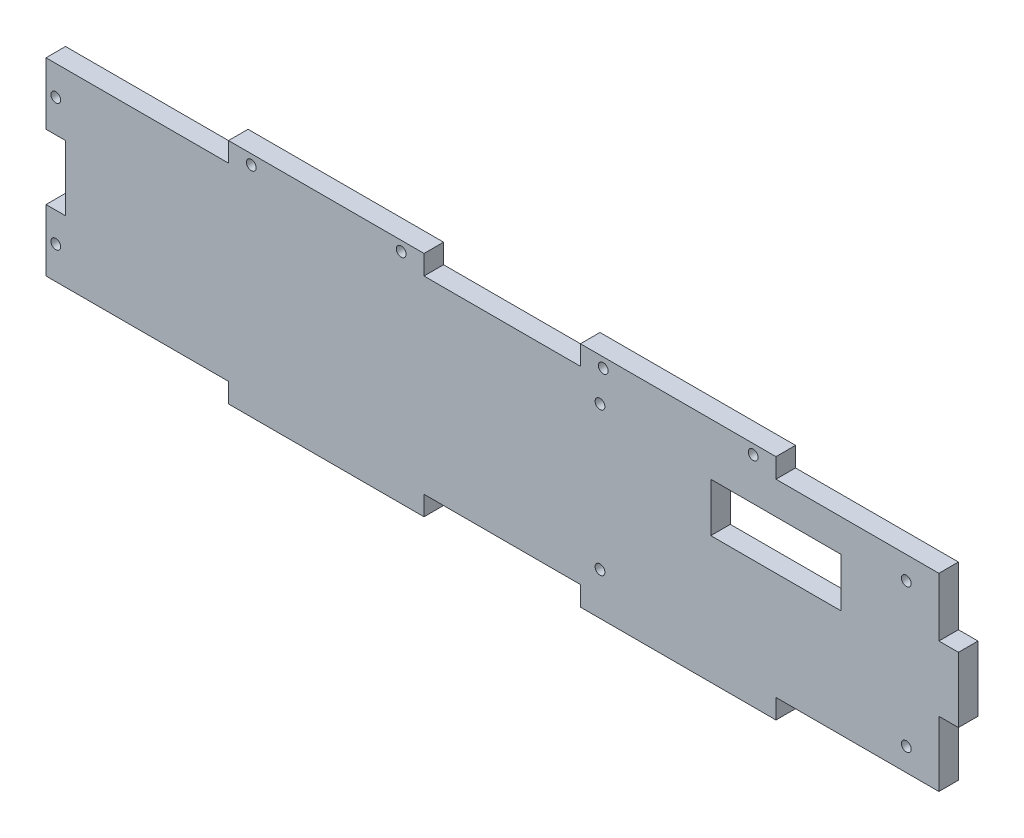
from build123d import *

# Parameters (mm, degrees)
ESQUISSE1_W             = 268
ESQUISSE1_H             = 70
BOSS_EXTRU_1_DEPTH      = 6
ESQUISSE2_W             = 50
ESQUISSE2_H             = 6
ESQUISSE2_W_2           = 48
ENL_V_MAT_EXTRU_1_DEPTH = 278.055951028
ESQUISSE3_W             = 6
ESQUISSE3_H             = 20
BOSS_EXTRU_2_DEPTH      = 6
ESQUISSE4_R             = 1.5
ESQUISSE4_W             = 40
ESQUISSE4_H             = 15
ENL_V_MAT_EXTRU_2_DEPTH = 10
ESQUISSE5_W             = 6
ESQUISSE5_H             = 19
BOSS_EXTRU_3_DEPTH      = 6
ESQUISSE6_R             = 1.5
ENL_V_MAT_EXTRU_3_DEPTH = 283.863924883
ESQUISSE7_R             = 2.995
ESQUISSE7_R_2           = 3
ENL_V_MAT_EXTRU_4_DEPTH = 3


with BuildPart() as part:
    # Esquisse1 → Boss.-Extru.1 (new body)
    with BuildSketch(Plane.XY):
        with Locations((-134, 35)):
            Rectangle(ESQUISSE1_W, ESQUISSE1_H)
    extrude(amount=BOSS_EXTRU_1_DEPTH)

    # Esquisse2 → Enlèv. mat.-Extru.1 (cut, through all)
    with BuildSketch(Plane.XY.offset(6)):
        with Locations((-243, 3)):
            Rectangle(ESQUISSE2_W, ESQUISSE2_H)
        with Locations((-25, 3)):
            Rectangle(ESQUISSE2_W, ESQUISSE2_H)
        with Locations((-134, 3)):
            Rectangle(ESQUISSE2_W_2, ESQUISSE2_H)
        with Locations((-243, 67)):
            Rectangle(ESQUISSE2_W, ESQUISSE2_H)
        with Locations((-134, 67)):
            Rectangle(ESQUISSE2_W_2, ESQUISSE2_H)
        with Locations((-25, 67)):
            Rectangle(ESQUISSE2_W, ESQUISSE2_H)
    extrude(amount=-ENL_V_MAT_EXTRU_1_DEPTH, mode=Mode.SUBTRACT)

    # Esquisse3 → Boss.-Extru.2 (add)
    with BuildSketch(Plane(origin=(0, 0, 0), x_dir=(0, 0, -1), z_dir=(1, 0, 0))):
        with Locations((-3, 36)):
            Rectangle(ESQUISSE3_W, ESQUISSE3_H)
    extrude(amount=BOSS_EXTRU_2_DEPTH)

    # Esquisse4 → Enlèv. mat.-Extru.2 (cut)
    with BuildSketch(Plane.XY.offset(6)):
        with Locations((-104, 57)):
            Circle(ESQUISSE4_R)
        with Locations((-104, 13)):
            Circle(ESQUISSE4_R)
        with Locations((-10, 57)):
            Circle(ESQUISSE4_R)
        with Locations((-10, 13)):
            Circle(ESQUISSE4_R)
        with Locations((-50, 46.5)):
            Rectangle(ESQUISSE4_W, ESQUISSE4_H)
    extrude(amount=-ENL_V_MAT_EXTRU_2_DEPTH, mode=Mode.SUBTRACT)

    # Esquisse5 → Boss.-Extru.3 (add)
    with BuildSketch(Plane.ZY.offset(268)):
        with Locations((3, 54.5)):
            Rectangle(ESQUISSE5_W, ESQUISSE5_H)
        with Locations((3, 15.5)):
            Rectangle(ESQUISSE5_W, ESQUISSE5_H)
    extrude(amount=BOSS_EXTRU_3_DEPTH)

    # Esquisse6 → Enlèv. mat.-Extru.3 (cut, through all)
    with BuildSketch(Plane(origin=(0, 0, 0), x_dir=(-1, 0, 0), z_dir=(0, 0, -1))):
        with Locations((271, 16)):
            Circle(ESQUISSE6_R)
        with Locations((271, 55)):
            Circle(ESQUISSE6_R)
        with Locations((211, 67)):
            Circle(ESQUISSE6_R)
        with Locations((165, 67)):
            Circle(ESQUISSE6_R)
        with Locations((103, 67)):
            Circle(ESQUISSE6_R)
        with Locations((57, 67)):
            Circle(ESQUISSE6_R)
    extrude(amount=-ENL_V_MAT_EXTRU_3_DEPTH, mode=Mode.SUBTRACT)

    # Esquisse7 → Enlèv. mat.-Extru.4 (cut)
    with BuildSketch(Plane(origin=(0, 0, 0), x_dir=(-1, 0, 0), z_dir=(0, 0, -1))):
        with Locations((271, 16)):
            Circle(ESQUISSE7_R)
        with Locations((271, 55)):
            Circle(ESQUISSE7_R)
        with Locations((211, 67)):
            Circle(ESQUISSE7_R)
        with Locations((165, 67)):
            Circle(ESQUISSE7_R)
        with Locations((103, 67)):
            Circle(ESQUISSE7_R)
        with Locations((57, 67)):
            Circle(ESQUISSE7_R)
        with Locations((104, 57)):
            Circle(ESQUISSE7_R_2)
        with Locations((104, 13)):
            Circle(ESQUISSE7_R_2)
        with Locations((10, 13)):
            Circle(ESQUISSE7_R_2)
        with Locations((10, 57)):
            Circle(ESQUISSE7_R_2)
    extrude(amount=-ENL_V_MAT_EXTRU_4_DEPTH, mode=Mode.SUBTRACT)


solid = part.part
